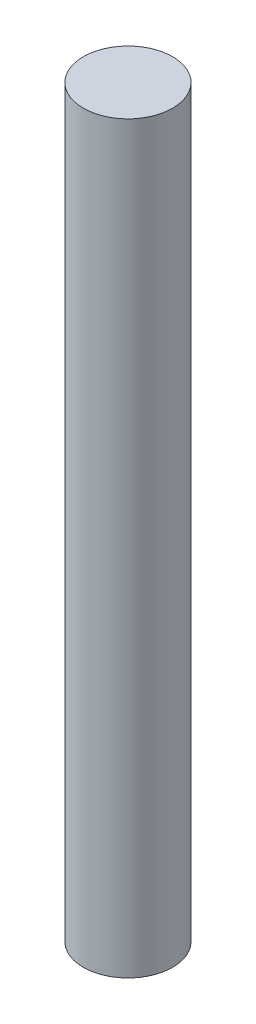
from build123d import *

# Parameters (mm, degrees)
SKETCH1_R           = 1.524
BOSS_EXTRUDE1_DEPTH = 25.4


with BuildPart() as part:
    # Sketch1 → Boss-Extrude1 (new body)
    with BuildSketch(Plane(origin=(0, 0, 0), x_dir=(1, 0, 0), z_dir=(0, 1, 0))):
        with Locations(Location((0, 0, 0), (0, 0, 270))):
            Circle(SKETCH1_R)
    extrude(amount=BOSS_EXTRUDE1_DEPTH)


solid = part.part
